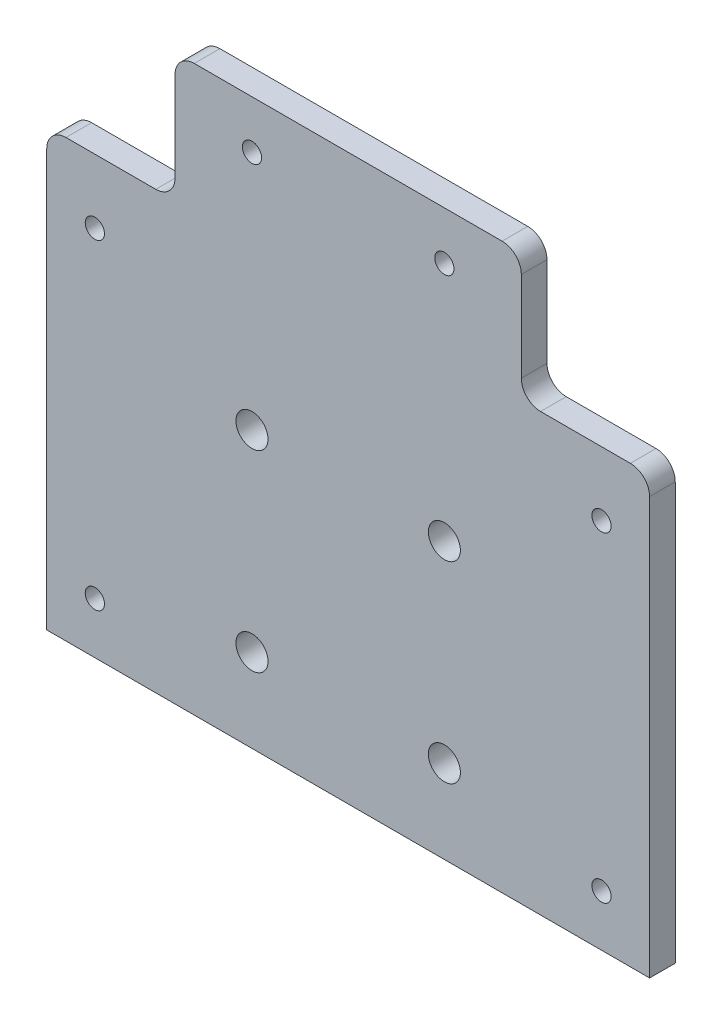
from build123d import *

# Parameters (mm, degrees)
SKETCH_1_W          = 94
SKETCH_1_H          = 88
EXTRUDE_1_DEPTH     = 4
SKETCH_2_W          = 20
SKETCH_2_H          = 20
CUT_EXTRUDE_1_DEPTH = 65.505813691
FILLET_1_R          = 3
SKETCH_3_R          = 2.5
CUT_EXTRUDE_2_DEPTH = 65.505813691
SKETCH_4_R          = 1.5
CUT_EXTRUDE_3_DEPTH = 65.505813691


with BuildPart() as part:
    # 草图1 → 凸台-拉伸1 (new body)
    with BuildSketch(Plane.XY):
        Rectangle(SKETCH_1_W, SKETCH_1_H)
    extrude(amount=EXTRUDE_1_DEPTH)

    # 草图2 → 切除-拉伸1 (cut, through all)
    with BuildSketch(Plane.XY.offset(4)):
        with Locations((-37, 34)):
            Rectangle(SKETCH_2_W, SKETCH_2_H)
        with Locations((37, 34)):
            Rectangle(SKETCH_2_W, SKETCH_2_H)
    extrude(amount=-CUT_EXTRUDE_1_DEPTH, mode=Mode.SUBTRACT)

    # 圆角1
    fillet_1_edges = [part.edges().sort_by_distance(p)[0] for p in [
        (-47, 24, 2),
        (-27, 44, 2),
        (-27, 24, 2),
        (27, 44, 2),
        (47, 24, 2),
        (27, 24, 2),
    ]]
    fillet(fillet_1_edges, radius=FILLET_1_R)

    # 草图3 → 切除-拉伸2 (cut, through all)
    with BuildSketch(Plane.XY.offset(4)):
        with Locations((-15, -1)):
            Circle(SKETCH_3_R)
        with Locations((15, -1)):
            Circle(SKETCH_3_R)
        with Locations((15, -31)):
            Circle(SKETCH_3_R)
        with Locations((-15, -31)):
            Circle(SKETCH_3_R)
    extrude(amount=-CUT_EXTRUDE_2_DEPTH, mode=Mode.SUBTRACT)

    # 草图4 → 切除-拉伸3 (cut, through all)
    with BuildSketch(Plane.XY.offset(4)):
        with Locations((-15, 36.5)):
            Circle(SKETCH_4_R)
        with Locations((39.5, 14)):
            Circle(SKETCH_4_R)
        with Locations((39.5, -36)):
            Circle(SKETCH_4_R)
        with Locations(Location((15, 36.5, 0), (0, 0, 180))):
            Circle(SKETCH_4_R)
        with Locations(Location((-39.5, -36, 0), (0, 0, 180))):
            Circle(SKETCH_4_R)
        with Locations(Location((-39.5, 14, 0), (0, 0, 180))):
            Circle(SKETCH_4_R)
    extrude(amount=-CUT_EXTRUDE_3_DEPTH, mode=Mode.SUBTRACT)


solid = part.part
